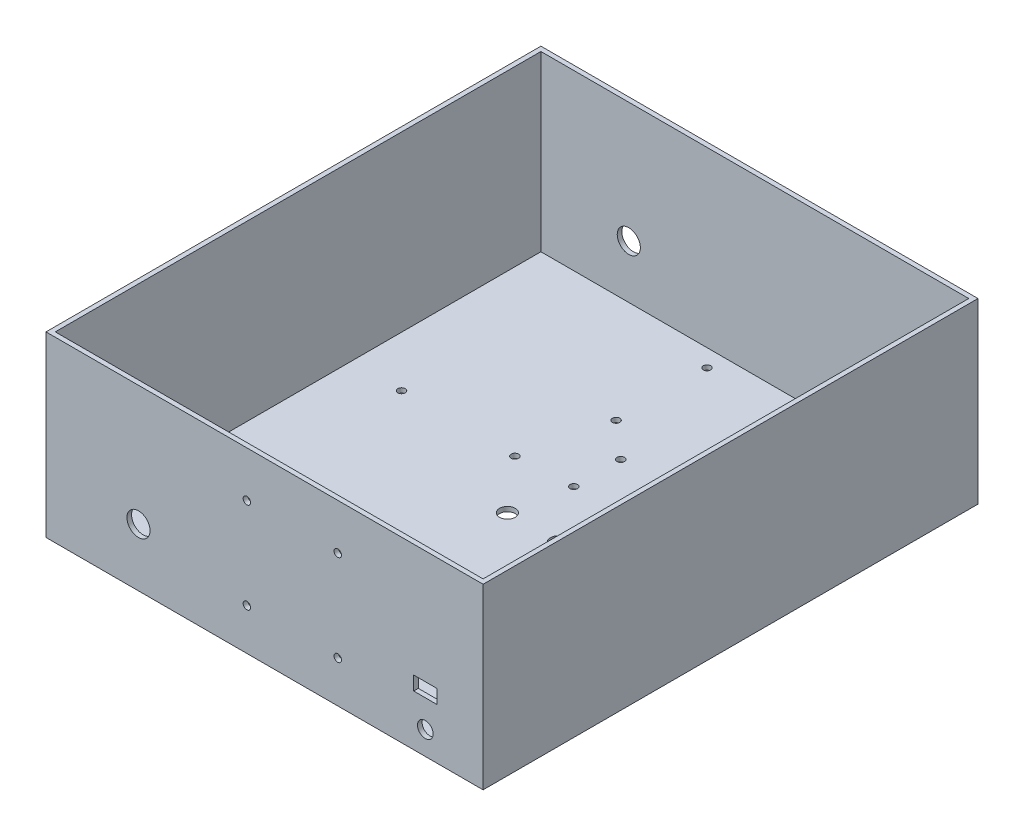
from build123d import *

# Parameters (mm, degrees)
SKETCH2_W               = 189
SKETCH2_H               = 214
SKETCH2_W_2             = 185
SKETCH2_H_2             = 210
WALLS_DEPTH             = 75
SKETCH3_W               = 189
SKETCH3_H               = 214
BASE_DEPTH              = 2
SKETCH4_R               = 5
SKETCH4_W               = 10
SKETCH4_H               = 6
CUT_EXTRUDE1_DEPTH      = 246.66491406
SKETCH5_R               = 3.3782
CUT_EXTRUDE2_DEPTH      = 246.66491406
F_1_4_CLEARANCE_HOLE1_D = 6.7564
CUT_EXTRUDE3_REACH      = 164.198
SKETCH9_R               = 1.6
CUT_EXTRUDE4_REACH      = 247.665
SKETCH10_R              = 1.6


with BuildPart() as part:
    # Sketch2 → Walls (new body)
    with BuildSketch(Plane(origin=(0, 0, 0), x_dir=(1, 0, 0), z_dir=(0, 1, 0))):
        Rectangle(SKETCH2_W, SKETCH2_H)
        Rectangle(SKETCH2_W_2, SKETCH2_H_2, mode=Mode.SUBTRACT)
    extrude(amount=WALLS_DEPTH)

    # Sketch3 → Base (add)
    with BuildSketch(Plane.XZ):
        Rectangle(SKETCH3_W, SKETCH3_H)
    extrude(amount=BASE_DEPTH)

    # Sketch4 → Cut-Extrude1 (cut, through all)
    with BuildSketch(Plane(origin=(0, 0, -107), x_dir=(-1, 0, 0), z_dir=(0, 0, -1))):
        with Locations((54.5, 23)):
            Circle(SKETCH4_R)
        with Locations((-69.5, 23)):
            Rectangle(SKETCH4_W, SKETCH4_H)
    extrude(amount=-CUT_EXTRUDE1_DEPTH, mode=Mode.SUBTRACT)

    # Sketch5 → Cut-Extrude2 (cut, through all)
    with BuildSketch(Plane(origin=(0, 0, -107), x_dir=(-1, 0, 0), z_dir=(0, 0, -1))):
        with Locations((-69.5, 8.09625)):
            Circle(SKETCH5_R)
    extrude(amount=-CUT_EXTRUDE2_DEPTH, mode=Mode.SUBTRACT)

    # 1/4 Clearance Hole1 (through all)
    with Locations(Plane(origin=(0, -2, 0), x_dir=(-1, 0, 0), z_dir=(0, -1, 0))):
        with Locations((-20, 0), (2, 0)):
            Hole(F_1_4_CLEARANCE_HOLE1_D / 2)

    # Sketch9 → Cut-Extrude3 (cut, up to next)
    with BuildSketch(Plane.XZ.offset(2), mode=Mode.PRIVATE) as cut_extrude3_sk1:
        with Locations(Location((82.9, 61.675, 0), (0, 0, 270))):
            Circle(SKETCH9_R)
    cut_extrude3_tool1 = extrude(cut_extrude3_sk1.sketch, amount=-CUT_EXTRUDE3_REACH, mode=Mode.PRIVATE) & part.part
    # Sketch9 → Cut-Extrude3 (cut, up to next)
    with BuildSketch(Plane.XZ.offset(2), mode=Mode.PRIVATE) as cut_extrude3_sk2:
        with Locations(Location((82.9, -61.675, 0), (0, 0, 270))):
            Circle(SKETCH9_R)
    cut_extrude3_tool2 = extrude(cut_extrude3_sk2.sketch, amount=-CUT_EXTRUDE3_REACH, mode=Mode.PRIVATE) & part.part
    # Sketch9 → Cut-Extrude3 (cut, up to next)
    with BuildSketch(Plane.XZ.offset(2), mode=Mode.PRIVATE) as cut_extrude3_sk3:
        with Locations(Location((39.9, 61.675, 0), (0, 0, 270))):
            Circle(SKETCH9_R)
    cut_extrude3_tool3 = extrude(cut_extrude3_sk3.sketch, amount=-CUT_EXTRUDE3_REACH, mode=Mode.PRIVATE) & part.part
    # Sketch9 → Cut-Extrude3 (cut, up to next)
    with BuildSketch(Plane.XZ.offset(2), mode=Mode.PRIVATE) as cut_extrude3_sk4:
        with Locations(Location((39.9, -61.675, 0), (0, 0, 270))):
            Circle(SKETCH9_R)
    cut_extrude3_tool4 = extrude(cut_extrude3_sk4.sketch, amount=-CUT_EXTRUDE3_REACH, mode=Mode.PRIVATE) & part.part
    # Sketch9 → Cut-Extrude3 (cut, up to next)
    with BuildSketch(Plane.XZ.offset(2), mode=Mode.PRIVATE) as cut_extrude3_sk5:
        with Locations(Location((26.170769447, -58.141754017, 0), (0, 0, 270))):
            Circle(SKETCH9_R)
    cut_extrude3_tool5 = extrude(cut_extrude3_sk5.sketch, amount=-CUT_EXTRUDE3_REACH, mode=Mode.PRIVATE) & part.part
    # Sketch9 → Cut-Extrude3 (cut, up to next)
    with BuildSketch(Plane.XZ.offset(2), mode=Mode.PRIVATE) as cut_extrude3_sk6:
        with Locations(Location((26.170769447, -97.441754017, 0), (0, 0, 270))):
            Circle(SKETCH9_R)
    cut_extrude3_tool6 = extrude(cut_extrude3_sk6.sketch, amount=-CUT_EXTRUDE3_REACH, mode=Mode.PRIVATE) & part.part
    # Sketch9 → Cut-Extrude3 (cut, up to next)
    with BuildSketch(Plane.XZ.offset(2), mode=Mode.PRIVATE) as cut_extrude3_sk7:
        with Locations(Location((-13.129230553, -58.141754017, 0), (0, 0, 270))):
            Circle(SKETCH9_R)
    cut_extrude3_tool7 = extrude(cut_extrude3_sk7.sketch, amount=-CUT_EXTRUDE3_REACH, mode=Mode.PRIVATE) & part.part
    # Sketch9 → Cut-Extrude3 (cut, up to next)
    with BuildSketch(Plane.XZ.offset(2), mode=Mode.PRIVATE) as cut_extrude3_sk8:
        with Locations(Location((-13.129230553, -97.441754017, 0), (0, 0, 270))):
            Circle(SKETCH9_R)
    cut_extrude3_tool8 = extrude(cut_extrude3_sk8.sketch, amount=-CUT_EXTRUDE3_REACH, mode=Mode.PRIVATE) & part.part
    # Sketch9 → Cut-Extrude3 (cut, up to next)
    with BuildSketch(Plane.XZ.offset(2), mode=Mode.PRIVATE) as cut_extrude3_sk9:
        with Locations(Location((22.84154278, -24.185222858, 0), (0, 0, 270))):
            Circle(SKETCH9_R)
    cut_extrude3_tool9 = extrude(cut_extrude3_sk9.sketch, amount=-CUT_EXTRUDE3_REACH, mode=Mode.PRIVATE) & part.part
    # Sketch9 → Cut-Extrude3 (cut, up to next)
    with BuildSketch(Plane.XZ.offset(2), mode=Mode.PRIVATE) as cut_extrude3_sk10:
        with Locations(Location((22.84154278, -44.485222858, 0), (0, 0, 270))):
            Circle(SKETCH9_R)
    cut_extrude3_tool10 = extrude(cut_extrude3_sk10.sketch, amount=-CUT_EXTRUDE3_REACH, mode=Mode.PRIVATE) & part.part
    # Sketch9 → Cut-Extrude3 (cut, up to next)
    with BuildSketch(Plane.XZ.offset(2), mode=Mode.PRIVATE) as cut_extrude3_sk11:
        with Locations(Location((2.54154278, -24.185222858, 0), (0, 0, 270))):
            Circle(SKETCH9_R)
    cut_extrude3_tool11 = extrude(cut_extrude3_sk11.sketch, amount=-CUT_EXTRUDE3_REACH, mode=Mode.PRIVATE) & part.part
    # Sketch9 → Cut-Extrude3 (cut, up to next)
    with BuildSketch(Plane.XZ.offset(2), mode=Mode.PRIVATE) as cut_extrude3_sk12:
        with Locations(Location((2.54154278, -44.485222858, 0), (0, 0, 270))):
            Circle(SKETCH9_R)
    cut_extrude3_tool12 = extrude(cut_extrude3_sk12.sketch, amount=-CUT_EXTRUDE3_REACH, mode=Mode.PRIVATE) & part.part
    # Sketch9 → Cut-Extrude3 (cut, up to next)
    with BuildSketch(Plane.XZ.offset(2), mode=Mode.PRIVATE) as cut_extrude3_sk13:
        with Locations(Location((-21.583449299, 35.175065187, 0), (0, 0, 270))):
            Circle(SKETCH9_R)
    cut_extrude3_tool13 = extrude(cut_extrude3_sk13.sketch, amount=-CUT_EXTRUDE3_REACH, mode=Mode.PRIVATE) & part.part
    # Sketch9 → Cut-Extrude3 (cut, up to next)
    with BuildSketch(Plane.XZ.offset(2), mode=Mode.PRIVATE) as cut_extrude3_sk14:
        with Locations(Location((-21.583449299, -22.824934813, 0), (0, 0, 270))):
            Circle(SKETCH9_R)
    cut_extrude3_tool14 = extrude(cut_extrude3_sk14.sketch, amount=-CUT_EXTRUDE3_REACH, mode=Mode.PRIVATE) & part.part
    # Sketch9 → Cut-Extrude3 (cut, up to next)
    with BuildSketch(Plane.XZ.offset(2), mode=Mode.PRIVATE) as cut_extrude3_sk15:
        with Locations(Location((-70.583449299, -22.824934813, 0), (0, 0, 270))):
            Circle(SKETCH9_R)
    cut_extrude3_tool15 = extrude(cut_extrude3_sk15.sketch, amount=-CUT_EXTRUDE3_REACH, mode=Mode.PRIVATE) & part.part
    # Sketch9 → Cut-Extrude3 (cut, up to next)
    with BuildSketch(Plane.XZ.offset(2), mode=Mode.PRIVATE) as cut_extrude3_sk16:
        with Locations(Location((-70.583449299, 35.175065187, 0), (0, 0, 270))):
            Circle(SKETCH9_R)
    cut_extrude3_tool16 = extrude(cut_extrude3_sk16.sketch, amount=-CUT_EXTRUDE3_REACH, mode=Mode.PRIVATE) & part.part
    # Sketch9 → Cut-Extrude3 (cut, up to next)
    with BuildSketch(Plane.XZ.offset(2), mode=Mode.PRIVATE) as cut_extrude3_sk17:
        with Locations(Location((-58.856871361, 58.63750142, 0), (0, 0, 270))):
            Circle(SKETCH9_R)
    cut_extrude3_tool17 = extrude(cut_extrude3_sk17.sketch, amount=-CUT_EXTRUDE3_REACH, mode=Mode.PRIVATE) & part.part
    # Sketch9 → Cut-Extrude3 (cut, up to next)
    with BuildSketch(Plane.XZ.offset(2), mode=Mode.PRIVATE) as cut_extrude3_sk18:
        with Locations(Location((-19.556871361, 58.63750142, 0), (0, 0, 270))):
            Circle(SKETCH9_R)
    cut_extrude3_tool18 = extrude(cut_extrude3_sk18.sketch, amount=-CUT_EXTRUDE3_REACH, mode=Mode.PRIVATE) & part.part
    # Sketch9 → Cut-Extrude3 (cut, up to next)
    with BuildSketch(Plane.XZ.offset(2), mode=Mode.PRIVATE) as cut_extrude3_sk19:
        with Locations(Location((-19.556871361, 97.93750142, 0), (0, 0, 270))):
            Circle(SKETCH9_R)
    cut_extrude3_tool19 = extrude(cut_extrude3_sk19.sketch, amount=-CUT_EXTRUDE3_REACH, mode=Mode.PRIVATE) & part.part
    # Sketch9 → Cut-Extrude3 (cut, up to next)
    with BuildSketch(Plane.XZ.offset(2), mode=Mode.PRIVATE) as cut_extrude3_sk20:
        with Locations(Location((-58.856871361, 97.93750142, 0), (0, 0, 270))):
            Circle(SKETCH9_R)
    cut_extrude3_tool20 = extrude(cut_extrude3_sk20.sketch, amount=-CUT_EXTRUDE3_REACH, mode=Mode.PRIVATE) & part.part
    add(cut_extrude3_tool1.solids().sort_by_distance((82.9, -2, 61.675))[0], mode=Mode.SUBTRACT)
    add(cut_extrude3_tool2.solids().sort_by_distance((82.9, -2, -61.675))[0], mode=Mode.SUBTRACT)
    add(cut_extrude3_tool3.solids().sort_by_distance((39.9, -2, 61.675))[0], mode=Mode.SUBTRACT)
    add(cut_extrude3_tool4.solids().sort_by_distance((39.9, -2, -61.675))[0], mode=Mode.SUBTRACT)
    add(cut_extrude3_tool5.solids().sort_by_distance((26.170769, -2, -58.141754))[0], mode=Mode.SUBTRACT)
    add(cut_extrude3_tool6.solids().sort_by_distance((26.170769, -2, -97.441754))[0], mode=Mode.SUBTRACT)
    add(cut_extrude3_tool7.solids().sort_by_distance((-13.129231, -2, -58.141754))[0], mode=Mode.SUBTRACT)
    add(cut_extrude3_tool8.solids().sort_by_distance((-13.129231, -2, -97.441754))[0], mode=Mode.SUBTRACT)
    add(cut_extrude3_tool9.solids().sort_by_distance((22.841543, -2, -24.185223))[0], mode=Mode.SUBTRACT)
    add(cut_extrude3_tool10.solids().sort_by_distance((22.841543, -2, -44.485223))[0], mode=Mode.SUBTRACT)
    add(cut_extrude3_tool11.solids().sort_by_distance((2.541543, -2, -24.185223))[0], mode=Mode.SUBTRACT)
    add(cut_extrude3_tool12.solids().sort_by_distance((2.541543, -2, -44.485223))[0], mode=Mode.SUBTRACT)
    add(cut_extrude3_tool13.solids().sort_by_distance((-21.583449, -2, 35.175065))[0], mode=Mode.SUBTRACT)
    add(cut_extrude3_tool14.solids().sort_by_distance((-21.583449, -2, -22.824935))[0], mode=Mode.SUBTRACT)
    add(cut_extrude3_tool15.solids().sort_by_distance((-70.583449, -2, -22.824935))[0], mode=Mode.SUBTRACT)
    add(cut_extrude3_tool16.solids().sort_by_distance((-70.583449, -2, 35.175065))[0], mode=Mode.SUBTRACT)
    add(cut_extrude3_tool17.solids().sort_by_distance((-58.856871, -2, 58.637501))[0], mode=Mode.SUBTRACT)
    add(cut_extrude3_tool18.solids().sort_by_distance((-19.556871, -2, 58.637501))[0], mode=Mode.SUBTRACT)
    add(cut_extrude3_tool19.solids().sort_by_distance((-19.556871, -2, 97.937501))[0], mode=Mode.SUBTRACT)
    add(cut_extrude3_tool20.solids().sort_by_distance((-58.856871, -2, 97.937501))[0], mode=Mode.SUBTRACT)

    # Sketch10 → Cut-Extrude4 (cut, up to next)
    with BuildSketch(Plane.XY.offset(107), mode=Mode.PRIVATE) as cut_extrude4_sk1:
        with Locations((-7.650141085, 55.256030586)):
            Circle(SKETCH10_R)
    cut_extrude4_tool1 = extrude(cut_extrude4_sk1.sketch, amount=-CUT_EXTRUDE4_REACH, mode=Mode.PRIVATE) & part.part
    # Sketch10 → Cut-Extrude4 (cut, up to next)
    with BuildSketch(Plane.XY.offset(107), mode=Mode.PRIVATE) as cut_extrude4_sk2:
        with Locations((31.649858915, 55.256030586)):
            Circle(SKETCH10_R)
    cut_extrude4_tool2 = extrude(cut_extrude4_sk2.sketch, amount=-CUT_EXTRUDE4_REACH, mode=Mode.PRIVATE) & part.part
    # Sketch10 → Cut-Extrude4 (cut, up to next)
    with BuildSketch(Plane.XY.offset(107), mode=Mode.PRIVATE) as cut_extrude4_sk3:
        with Locations((31.649858915, 15.956030586)):
            Circle(SKETCH10_R)
    cut_extrude4_tool3 = extrude(cut_extrude4_sk3.sketch, amount=-CUT_EXTRUDE4_REACH, mode=Mode.PRIVATE) & part.part
    # Sketch10 → Cut-Extrude4 (cut, up to next)
    with BuildSketch(Plane.XY.offset(107), mode=Mode.PRIVATE) as cut_extrude4_sk4:
        with Locations((-7.650141085, 15.956030586)):
            Circle(SKETCH10_R)
    cut_extrude4_tool4 = extrude(cut_extrude4_sk4.sketch, amount=-CUT_EXTRUDE4_REACH, mode=Mode.PRIVATE) & part.part
    add(cut_extrude4_tool1.solids().sort_by_distance((-7.650141, 55.256031, 107))[0], mode=Mode.SUBTRACT)
    add(cut_extrude4_tool2.solids().sort_by_distance((31.649859, 55.256031, 107))[0], mode=Mode.SUBTRACT)
    add(cut_extrude4_tool3.solids().sort_by_distance((31.649859, 15.956031, 107))[0], mode=Mode.SUBTRACT)
    add(cut_extrude4_tool4.solids().sort_by_distance((-7.650141, 15.956031, 107))[0], mode=Mode.SUBTRACT)


solid = part.part
